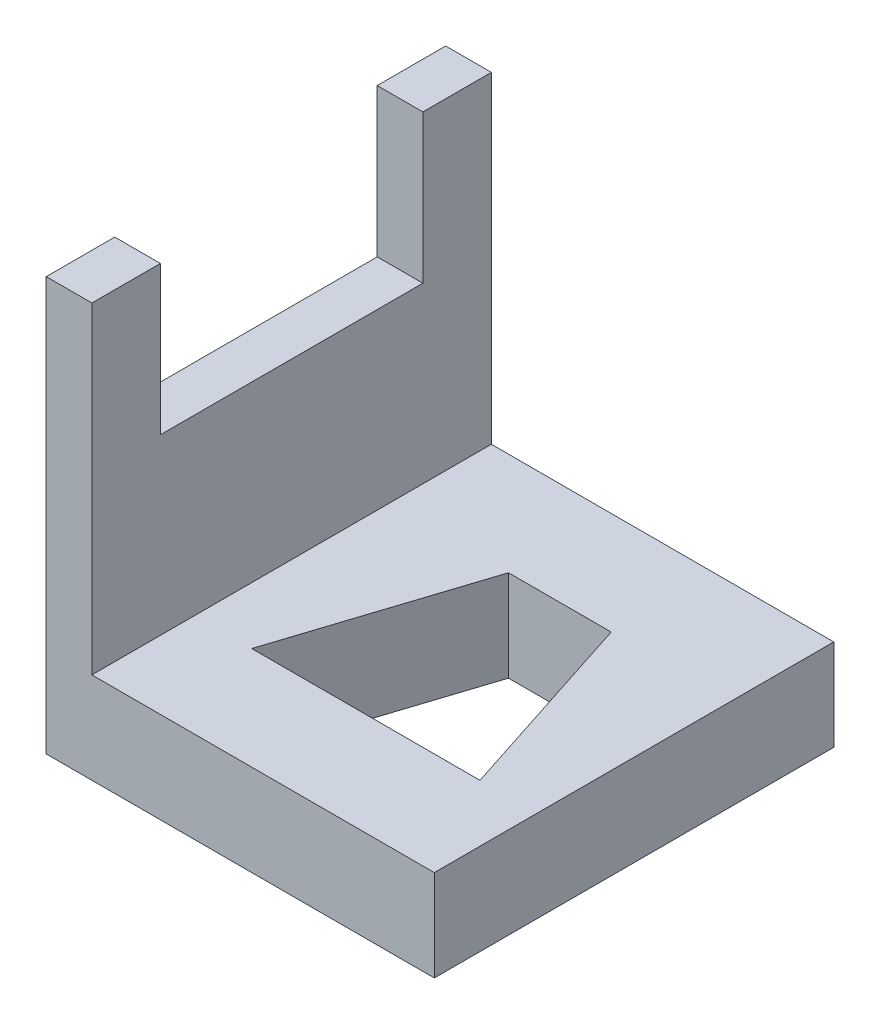
from build123d import *

# Parameters (mm, degrees)
Y_KSEKLIK_EKSTR_ZYON1_DEPTH = 1778
IZIM3_W                     = 1168.4
IZIM3_H                     = 660.4
KES_EKSTR_ZYON1_DEPTH       = 203.2
KES_EKSTR_ZYON2_DEPTH       = 406.4


with BuildPart() as part:
    # Çizim1 → Yükseklik-Ekstrüzyon1 (new body)
    with BuildSketch(Plane.XY):
        Polygon((-3680.580952381, 1222.865979381), (-3680.580952381, -617.10652921), (-1953.380952381, -617.10652921), (-1953.380952381, -210.70652921), (-3477.380952381, -210.70652921), (-3477.380952381, 1222.865979381), align=None)
    extrude(amount=Y_KSEKLIK_EKSTR_ZYON1_DEPTH)

    # Çizim3 → Kes-Ekstrüzyon1 (cut)
    with BuildSketch(Plane.ZY.offset(3680.580952381)):
        with Locations((889, 892.665979381)):
            Rectangle(IZIM3_W, IZIM3_H)
    extrude(amount=-KES_EKSTR_ZYON1_DEPTH, mode=Mode.SUBTRACT)

    # Çizim4 → Kes-Ekstrüzyon2 (cut)
    with BuildSketch(Plane(origin=(0, -210.70652921, 0), x_dir=(1, 0, 0), z_dir=(0, 1, 0))):
        Polygon((-2943.980952381, -457.2), (-2486.780952381, -457.2), (-2207.380952381, -1320.8), (-3223.380952381, -1320.8), align=None)
    extrude(amount=-KES_EKSTR_ZYON2_DEPTH, mode=Mode.SUBTRACT)


solid = part.part
